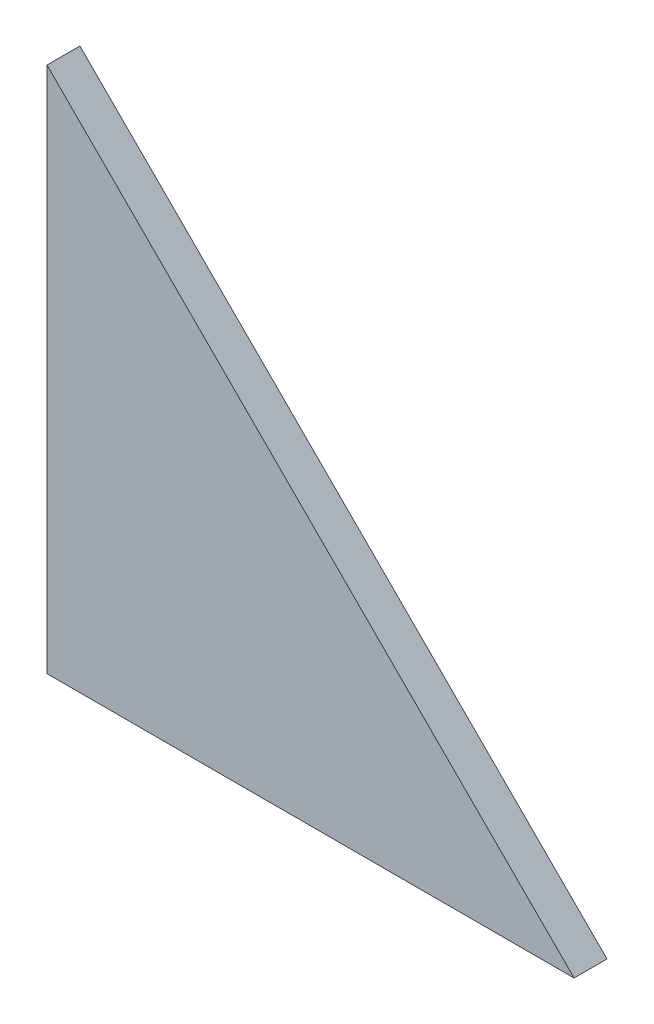
from build123d import *

# Parameters (mm, degrees)
BOSS_EXTRUDE1_DEPTH = 9.525


with BuildPart() as part:
    # Sketch1 → Boss-Extrude1 (new, symmetric)
    with BuildSketch(Plane.XY):
        Polygon((0, 0), (304.8, 0), (0, 304.8), align=None)
    extrude(amount=BOSS_EXTRUDE1_DEPTH, both=True)


solid = part.part
